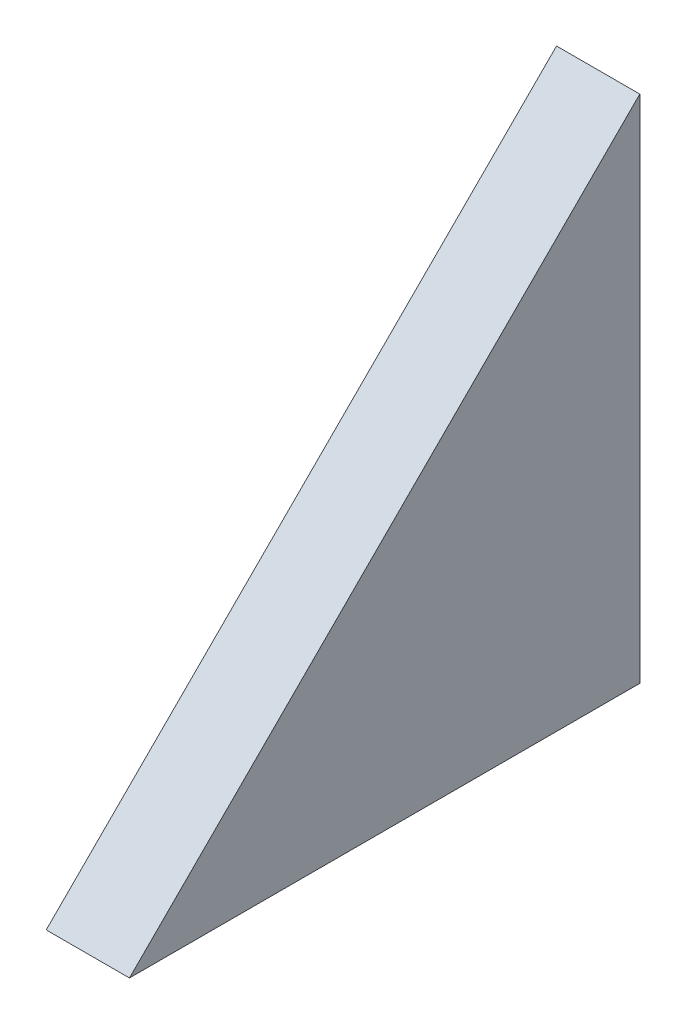
from build123d import *

# Parameters (mm, degrees)
BOSS_EXTRUDE1_DEPTH = 19.05


with BuildPart() as part:
    # Sketch1 → Boss-Extrude1 (new body)
    with BuildSketch(Plane(origin=(0, 0, 0), x_dir=(0, 0, -1), z_dir=(1, 0, 0))):
        Polygon((-39.52275112, 96.954715642), (-156.266080694, -19.788613932), (-39.52275112, -19.788613932), align=None)
    extrude(amount=BOSS_EXTRUDE1_DEPTH)


solid = part.part
